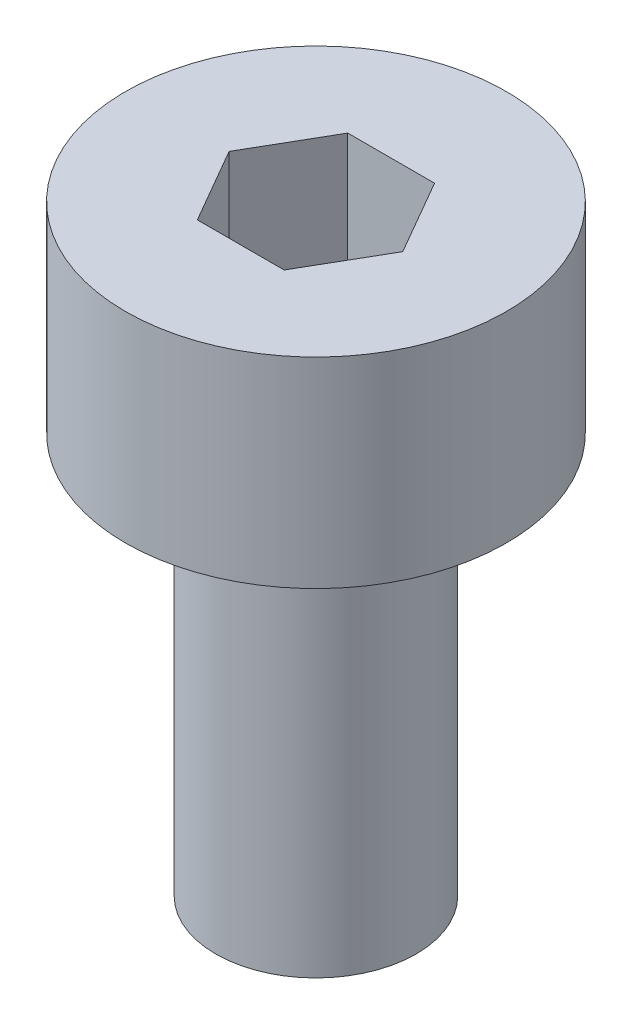
from build123d import *

# Parameters (mm, degrees)
CUT_EXTRUDE1_DEPTH = 1.5


with BuildPart() as part:
    # Sketch1 → Revolve1 (revolve)
    with BuildSketch(Plane.XY, mode=Mode.PRIVATE) as revolve1_sk:
        Polygon((0, -4), (1, -4), (1, 0), (1.9, 0), (1.9, 2), (0, 2), align=None)
    revolve(revolve1_sk.sketch.rotate(Axis((0, 61.691642626, 0), (0, -1, 0)), 90), axis=Axis((0, 61.691642626, 0), (0, -1, 0)))

    # Sketch2 → Cut-Extrude1 (cut)
    with BuildSketch(Plane(origin=(0, 2, 0), x_dir=(-1, 0, 0), z_dir=(0, 1, 0))):
        Polygon((-0.433012702, -0.75), (0.433012702, -0.75), (0.866025404, 0), (0.433012702, 0.75), (-0.433012702, 0.75), (-0.866025404, 0), align=None)
    extrude(amount=-CUT_EXTRUDE1_DEPTH, mode=Mode.SUBTRACT)


solid = part.part
